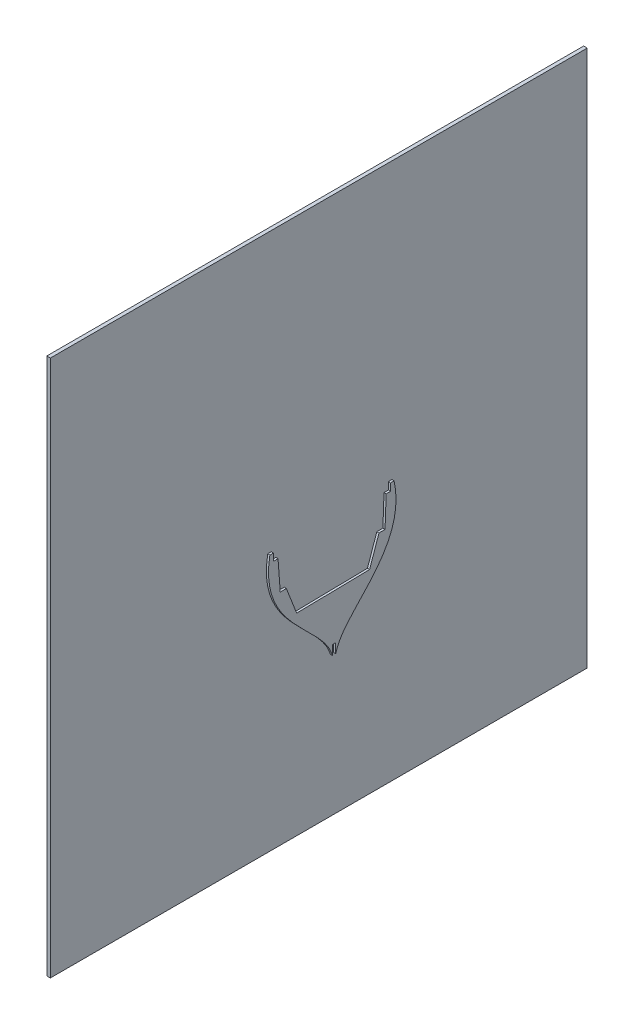
from build123d import *

# Parameters (mm, degrees)
BOSS_EXTRU_2_DEPTH      = 10
BOSS_EXTRU_3_DEPTH      = 6
ENL_V_MAT_EXTRU_1_DEPTH = 6


with BuildPart() as part:
    # Esquisse3D1 → Boss.-Extru.2 (new body)
    with BuildSketch(Plane(origin=(-20, 1121.289346724, 777.274991403), x_dir=(0, -0.7071067811865476, -0.7071067811865476), z_dir=(1, 0, 0))):
        Polygon((0, 0), (1060.66017178, 1060.66017178), (2121.32034356, 0), (1060.66017178, -1060.66017178), align=None)
    extrude(amount=BOSS_EXTRU_2_DEPTH)


with BuildPart() as body_2:
    # Esquisse5 → Boss.-Extru.3 (new body)
    with BuildSketch(Plane(origin=(0, 0, 0), x_dir=(0, 0, -1), z_dir=(1, 0, 0))):
        with BuildLine():
            Line((167.039822401, 360.16908577), (157.039822401, 359.987931998))
            Line((157.039822401, 359.987931998), (157.21449267, 339.6924785))
            Line((157.21449267, 339.6924785), (144.923491305, 339.469822374))
            Line((144.923491305, 339.469822374), (141.825983952, 255.190482283))
            Line((141.825983952, 255.190482283), (124.84757632, 254.882912023))
            Line((124.84757632, 254.882912023), (98.691723454, 179.646068268))
            Line((98.691723454, 179.646068268), (-105.133547346, 175.953696593))
            Line((-105.133547346, 175.953696593), (-133.997232238, 250.193840666))
            Line((-133.997232238, 250.193840666), (-150.97563987, 249.886270406))
            Line((-150.97563987, 249.886270406), (-157.123617242, 333.998125053))
            Line((-157.123617242, 333.998125053), (-169.414618607, 333.775468927))
            Line((-169.414618607, 333.775468927), (-169.975141307, 354.063932562))
            Line((-169.975141307, 354.063932562), (-179.975141307, 353.882778789))
            add(Edge.make_bspline(
                [(0, 0), (-7.26042253, 40.553195008), (-12.035367719, 109.306012211), (-215.65519077, 157.878809234), (-179.975141307, 353.882778789)],
                knots=[0, 0, 0, 0, 0, 1, 1, 1, 1, 1], degree=4))
            add(Edge.make_bspline(
                [(0, 0), (5.786867989, 40.789551598), (8.06853099, 109.670201921), (209.795503557, 165.586009065), (167.039822401, 360.16908577)],
                knots=[0, 0, 0, 0, 0, 1, 1, 1, 1, 1], degree=4))
        make_face()
    extrude(amount=BOSS_EXTRU_3_DEPTH)

    # Esquisse6 → Enlèv. mat.-Extru.1 (cut)
    with BuildSketch(Plane(origin=(6, 0, 0), x_dir=(0, 0, -1), z_dir=(1, 0, 0))):
        Polygon((-4.917100529, 22.943147819), (-5.406215715, 49.943147819), (3.593784285, 50.106186214), (4.082899471, 23.106186214), (117.063261114, -47.52702125), (-85.227699586, -65.220017949), align=None)
    extrude(amount=-ENL_V_MAT_EXTRU_1_DEPTH, mode=Mode.SUBTRACT)


solid = Compound([part.part, body_2.part])
